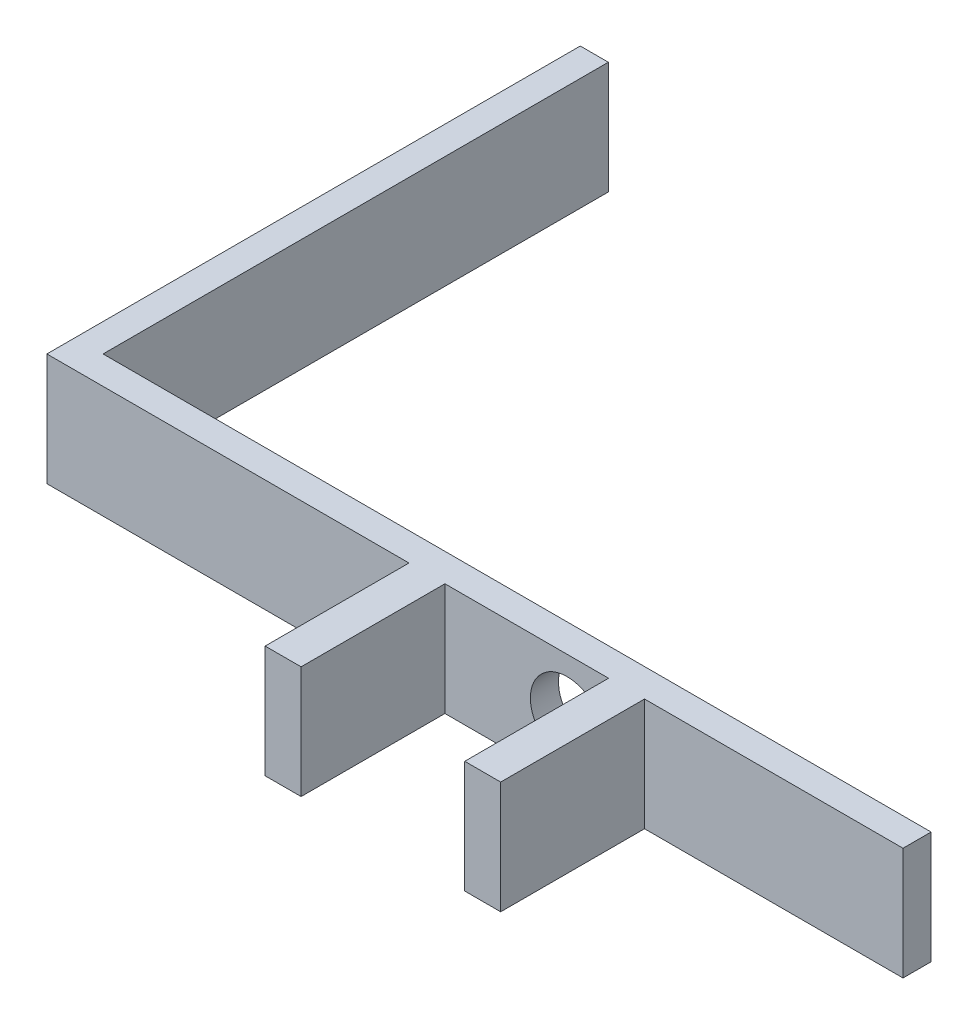
from build123d import *

# Parameters (mm, degrees)
BOSS_EXTRUDE1_DEPTH = 7.9375
SKETCH2_R           = 5.207
CUT_EXTRUDE1_DEPTH  = 3.96875
SKETCH4_W           = 5.08
SKETCH4_H           = 15.875
BOSS_EXTRUDE2_DEPTH = 20.32


with BuildPart() as part:
    # Sketch1 → Boss-Extrude1 (new, symmetric)
    with BuildSketch(Plane(origin=(0, 0, 0), x_dir=(1, 0, 0), z_dir=(0, 1, 0))):
        Polygon((0, 0), (3.96875, 0), (120.93575, 0), (120.93575, 3.96875), (3.96875, 3.96875), (3.96875, 75.34275), (0, 75.34275), align=None)
    extrude(amount=BOSS_EXTRUDE1_DEPTH, both=True)

    # Sketch2 → Cut-Extrude1 (cut)
    with BuildSketch(Plane.XY):
        with Locations((73.50125, 0)):
            Circle(SKETCH2_R)
    extrude(amount=-CUT_EXTRUDE1_DEPTH, mode=Mode.SUBTRACT)

    # Sketch4 → Boss-Extrude2 (add)
    with BuildSketch(Plane.XY):
        with Locations((53.68925, 0)):
            Rectangle(SKETCH4_W, SKETCH4_H)
        with Locations((81.88325, 0)):
            Rectangle(SKETCH4_W, SKETCH4_H)
    extrude(amount=BOSS_EXTRUDE2_DEPTH)


solid = part.part
